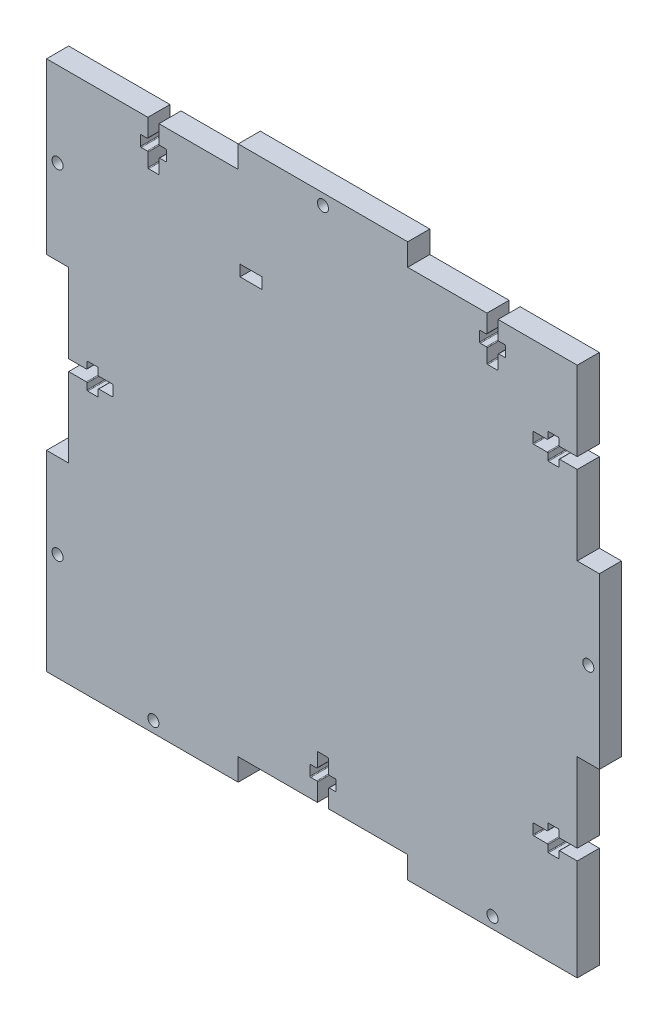
from build123d import *

# Parameters (mm, degrees)
BOX_SIDE_DEPTH       = 6
SKETCH2_R            = 1.5
SCREW_CUT_OUTS_DEPTH = 107.235587258
SKETCH3_W            = 6
SKETCH3_H            = 3
CUT_EXTRUDE1_DEPTH   = 107.235587258


with BuildPart() as part:
    # Sketch1 → Box Side (new body)
    with BuildSketch(Plane.XY):
        Polygon((-69, 69), (-23, 69), (-23, 75), (23, 75), (23, 69), (69, 69), (69, 23), (75, 23), (75, -23), (69, -23), (69, -69), (69, -75), (23, -75), (23, -69), (-23, -69), (-23, -75), (-69, -75), (-75, -75), (-75, -69), (-75, -23), (-69, -23), (-69, 23), (-75, 23), (-75, 69), align=None)
    extrude(amount=BOX_SIDE_DEPTH)

    # Sketch2 → Screw Cut-outs (cut, through all)
    with BuildSketch(Plane.XY.offset(6)):
        with Locations((0, 72)):
            Circle(SKETCH2_R)
        with Locations(Location((72, 0, 0), (0, 0, 180))):
            Circle(SKETCH2_R)
        with Locations((-46, -72)):
            Circle(SKETCH2_R)
        with Locations(Location((46, -72, 0), (0, 0, 180))):
            Circle(SKETCH2_R)
        with Locations((-72, 46)):
            Circle(SKETCH2_R)
        with Locations(Location((-72, -46, 0), (0, 0, 180))):
            Circle(SKETCH2_R)
        with BuildLine():
            Line((-44.5, 69), (-44.5, 64.2))
            ThreePointArc((-44.5, 64.2), (-44.441421356, 64.058578644), (-44.3, 64))
            Line((-44.3, 64), (-42.7, 64))
            ThreePointArc((-42.7, 64), (-42.558578644, 63.941421356), (-42.5, 63.8))
            Line((-42.5, 63.8), (-42.5, 61.2))
            ThreePointArc((-42.5, 61.2), (-42.558578644, 61.058578644), (-42.7, 61))
            Line((-42.7, 61), (-44.3, 61))
            ThreePointArc((-44.3, 61), (-44.441421356, 60.941421356), (-44.5, 60.8))
            Line((-44.5, 60.8), (-44.5, 57.2))
            ThreePointArc((-44.5, 57.2), (-44.558578644, 57.058578644), (-44.7, 57))
            Line((-44.7, 57), (-47.3, 57))
            ThreePointArc((-47.3, 57), (-47.441421356, 57.058578644), (-47.5, 57.2))
            Line((-47.5, 57.2), (-47.5, 60.8))
            ThreePointArc((-47.5, 60.8), (-47.558578644, 60.941421356), (-47.7, 61))
            Line((-47.7, 61), (-49.3, 61))
            ThreePointArc((-49.3, 61), (-49.441421356, 61.058578644), (-49.5, 61.2))
            Line((-49.5, 61.2), (-49.5, 63.8))
            ThreePointArc((-49.5, 63.8), (-49.441421356, 63.941421356), (-49.3, 64))
            Line((-49.3, 64), (-47.7, 64))
            ThreePointArc((-47.7, 64), (-47.558578644, 64.058578644), (-47.5, 64.2))
            Line((-47.5, 64.2), (-47.5, 69))
            Line((-47.5, 69), (-44.5, 69))
        make_face()
        with BuildLine():
            Line((47.5, 69), (47.5, 64.2))
            ThreePointArc((47.5, 64.2), (47.558578644, 64.058578644), (47.7, 64))
            Line((47.7, 64), (49.3, 64))
            ThreePointArc((49.3, 64), (49.441421356, 63.941421356), (49.5, 63.8))
            Line((49.5, 63.8), (49.5, 61.2))
            ThreePointArc((49.5, 61.2), (49.441421356, 61.058578644), (49.3, 61))
            Line((49.3, 61), (47.7, 61))
            ThreePointArc((47.7, 61), (47.558578644, 60.941421356), (47.5, 60.8))
            Line((47.5, 60.8), (47.5, 57.2))
            ThreePointArc((47.5, 57.2), (47.441421356, 57.058578644), (47.3, 57))
            Line((47.3, 57), (44.7, 57))
            ThreePointArc((44.7, 57), (44.558578644, 57.058578644), (44.5, 57.2))
            Line((44.5, 57.2), (44.5, 60.8))
            ThreePointArc((44.5, 60.8), (44.441421356, 60.941421356), (44.3, 61))
            Line((44.3, 61), (42.7, 61))
            ThreePointArc((42.7, 61), (42.558578644, 61.058578644), (42.5, 61.2))
            Line((42.5, 61.2), (42.5, 63.8))
            ThreePointArc((42.5, 63.8), (42.558578644, 63.941421356), (42.7, 64))
            Line((42.7, 64), (44.3, 64))
            ThreePointArc((44.3, 64), (44.441421356, 64.058578644), (44.5, 64.2))
            Line((44.5, 64.2), (44.5, 69))
            Line((44.5, 69), (47.5, 69))
        make_face()
        with BuildLine():
            Line((69, 44.5), (64.2, 44.5))
            ThreePointArc((64.2, 44.5), (64.058578644, 44.441421356), (64, 44.3))
            Line((64, 44.3), (64, 42.7))
            ThreePointArc((64, 42.7), (63.941421356, 42.558578644), (63.8, 42.5))
            Line((63.8, 42.5), (61.2, 42.5))
            ThreePointArc((61.2, 42.5), (61.058578644, 42.558578644), (61, 42.7))
            Line((61, 42.7), (61, 44.3))
            ThreePointArc((61, 44.3), (60.941421356, 44.441421356), (60.8, 44.5))
            Line((60.8, 44.5), (57.2, 44.5))
            ThreePointArc((57.2, 44.5), (57.058578644, 44.558578644), (57, 44.7))
            Line((57, 44.7), (57, 47.3))
            ThreePointArc((57, 47.3), (57.058578644, 47.441421356), (57.2, 47.5))
            Line((57.2, 47.5), (60.8, 47.5))
            ThreePointArc((60.8, 47.5), (60.941421356, 47.558578644), (61, 47.7))
            Line((61, 47.7), (61, 49.3))
            ThreePointArc((61, 49.3), (61.058578644, 49.441421356), (61.2, 49.5))
            Line((61.2, 49.5), (63.8, 49.5))
            ThreePointArc((63.8, 49.5), (63.941421356, 49.441421356), (64, 49.3))
            Line((64, 49.3), (64, 47.7))
            ThreePointArc((64, 47.7), (64.058578644, 47.558578644), (64.2, 47.5))
            Line((64.2, 47.5), (69, 47.5))
            Line((69, 47.5), (69, 44.5))
        make_face()
        with BuildLine():
            Line((69, -47.5), (64.2, -47.5))
            ThreePointArc((64.2, -47.5), (64.058578644, -47.558578644), (64, -47.7))
            Line((64, -47.7), (64, -49.3))
            ThreePointArc((64, -49.3), (63.941421356, -49.441421356), (63.8, -49.5))
            Line((63.8, -49.5), (61.2, -49.5))
            ThreePointArc((61.2, -49.5), (61.058578644, -49.441421356), (61, -49.3))
            Line((61, -49.3), (61, -47.7))
            ThreePointArc((61, -47.7), (60.941421356, -47.558578644), (60.8, -47.5))
            Line((60.8, -47.5), (57.2, -47.5))
            ThreePointArc((57.2, -47.5), (57.058578644, -47.441421356), (57, -47.3))
            Line((57, -47.3), (57, -44.7))
            ThreePointArc((57, -44.7), (57.058578644, -44.558578644), (57.2, -44.5))
            Line((57.2, -44.5), (60.8, -44.5))
            ThreePointArc((60.8, -44.5), (60.941421356, -44.441421356), (61, -44.3))
            Line((61, -44.3), (61, -42.7))
            ThreePointArc((61, -42.7), (61.058578644, -42.558578644), (61.2, -42.5))
            Line((61.2, -42.5), (63.8, -42.5))
            ThreePointArc((63.8, -42.5), (63.941421356, -42.558578644), (64, -42.7))
            Line((64, -42.7), (64, -44.3))
            ThreePointArc((64, -44.3), (64.058578644, -44.441421356), (64.2, -44.5))
            Line((64.2, -44.5), (69, -44.5))
            Line((69, -44.5), (69, -47.5))
        make_face()
        with BuildLine():
            Line((-1.5, -69), (1.5, -69))
            Line((1.5, -69), (1.5, -64.2))
            ThreePointArc((1.5, -64.2), (1.558578644, -64.058578644), (1.7, -64))
            Line((1.7, -64), (3.3, -64))
            ThreePointArc((3.3, -64), (3.441421356, -63.941421356), (3.5, -63.8))
            Line((3.5, -63.8), (3.5, -61.2))
            ThreePointArc((3.5, -61.2), (3.441421356, -61.058578644), (3.3, -61))
            Line((3.3, -61), (1.7, -61))
            ThreePointArc((1.7, -61), (1.558578644, -60.941421356), (1.5, -60.8))
            Line((1.5, -60.8), (1.5, -57.2))
            ThreePointArc((1.5, -57.2), (1.441421356, -57.058578644), (1.3, -57))
            Line((1.3, -57), (-1.3, -57))
            ThreePointArc((-1.3, -57), (-1.441421356, -57.058578644), (-1.5, -57.2))
            Line((-1.5, -57.2), (-1.5, -60.8))
            ThreePointArc((-1.5, -60.8), (-1.558578644, -60.941421356), (-1.7, -61))
            Line((-1.7, -61), (-3.3, -61))
            ThreePointArc((-3.3, -61), (-3.441421356, -61.058578644), (-3.5, -61.2))
            Line((-3.5, -61.2), (-3.5, -63.8))
            ThreePointArc((-3.5, -63.8), (-3.441421356, -63.941421356), (-3.3, -64))
            Line((-3.3, -64), (-1.7, -64))
            ThreePointArc((-1.7, -64), (-1.558578644, -64.058578644), (-1.5, -64.2))
            Line((-1.5, -64.2), (-1.5, -69))
        make_face()
        with BuildLine():
            Line((-69, -1.5), (-64.2, -1.5))
            ThreePointArc((-64.2, -1.5), (-64.058578644, -1.558578644), (-64, -1.7))
            Line((-64, -1.7), (-64, -3.3))
            ThreePointArc((-64, -3.3), (-63.941421356, -3.441421356), (-63.8, -3.5))
            Line((-63.8, -3.5), (-61.2, -3.5))
            ThreePointArc((-61.2, -3.5), (-61.058578644, -3.441421356), (-61, -3.3))
            Line((-61, -3.3), (-61, -1.7))
            ThreePointArc((-61, -1.7), (-60.941421356, -1.558578644), (-60.8, -1.5))
            Line((-60.8, -1.5), (-57.2, -1.5))
            ThreePointArc((-57.2, -1.5), (-57.058578644, -1.441421356), (-57, -1.3))
            Line((-57, -1.3), (-57, 1.3))
            ThreePointArc((-57, 1.3), (-57.058578644, 1.441421356), (-57.2, 1.5))
            Line((-57.2, 1.5), (-60.8, 1.5))
            ThreePointArc((-60.8, 1.5), (-60.941421356, 1.558578644), (-61, 1.7))
            Line((-61, 1.7), (-61, 3.3))
            ThreePointArc((-61, 3.3), (-61.058578644, 3.441421356), (-61.2, 3.5))
            Line((-61.2, 3.5), (-63.8, 3.5))
            ThreePointArc((-63.8, 3.5), (-63.941421356, 3.441421356), (-64, 3.3))
            Line((-64, 3.3), (-64, 1.7))
            ThreePointArc((-64, 1.7), (-64.058578644, 1.558578644), (-64.2, 1.5))
            Line((-64.2, 1.5), (-69, 1.5))
            Line((-69, 1.5), (-69, -1.5))
        make_face()
    extrude(amount=-SCREW_CUT_OUTS_DEPTH, mode=Mode.SUBTRACT)

    # Sketch3 → Cut-Extrude1 (cut, through all)
    with BuildSketch(Plane.XY.offset(6)):
        with Locations((-19.5, 45.5)):
            Rectangle(SKETCH3_W, SKETCH3_H)
    extrude(amount=-CUT_EXTRUDE1_DEPTH, mode=Mode.SUBTRACT)


solid = part.part
